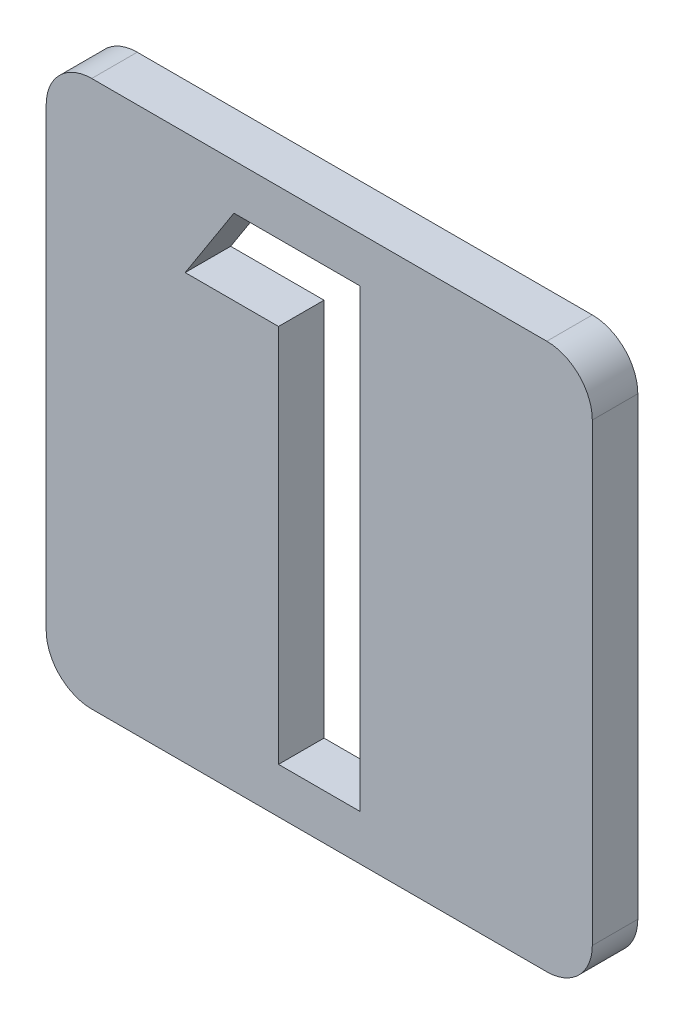
from build123d import *

# Parameters (mm, degrees)
BOSS_EXTRUDE1_DEPTH = 10
CUT_EXTRUDE2_DEPTH  = 10


with BuildPart() as part:
    # Sketch1 → Boss-Extrude1 (new body)
    with BuildSketch(Plane.XY):
        with BuildLine():
            Line((-50, 60), (50, 60))
            ThreePointArc((50, 60), (57.071067812, 57.071067812), (60, 50))
            Line((60, 50), (60, -50))
            ThreePointArc((60, -50), (57.071067812, -57.071067812), (50, -60))
            Line((50, -60), (-50, -60))
            ThreePointArc((-50, -60), (-57.071067812, -57.071067812), (-60, -50))
            Line((-60, -50), (-60, 50))
            ThreePointArc((-60, 50), (-57.071067812, 57.071067812), (-50, 60))
        make_face()
    extrude(amount=BOSS_EXTRUDE1_DEPTH)

    # Sketch2 → Cut-Extrude2 (cut)
    with BuildSketch(Plane.XY.offset(10)):
        Polygon((-18.744391026, 50), (9, 50), (9, -50), (-8.948717949, -50), (-8.948717949, 33.333333333), (-29.461538462, 33.333333333), align=None)
    extrude(amount=-CUT_EXTRUDE2_DEPTH, mode=Mode.SUBTRACT)


solid = part.part
